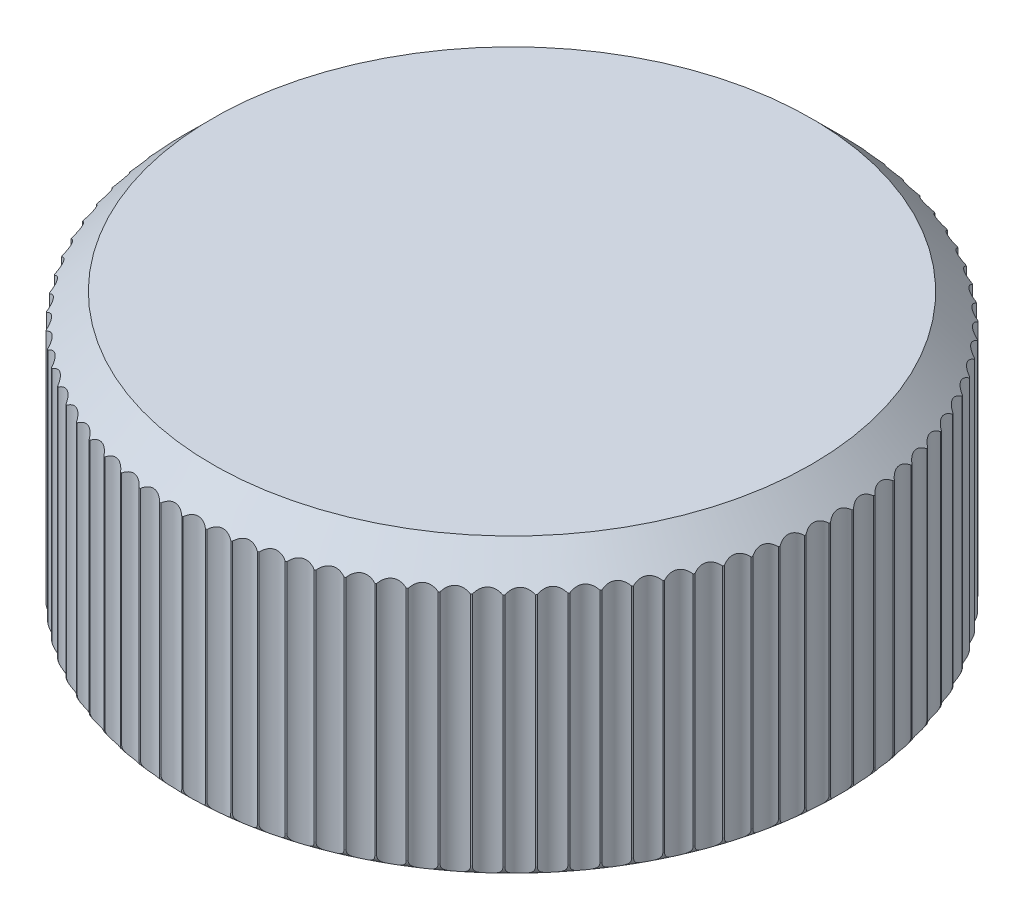
from build123d import *

# Parameters (mm, degrees)
SKIZZE2_R                       = 18.511660762
SCHNITT_LINEAR_AUSTRAGEN1_DEPTH = 28.109776895


with BuildPart() as part:
    # Skizze1 → Rotation1 (revolve)
    with BuildSketch(Plane.XY, mode=Mode.PRIVATE) as rotation1_sk:
        with BuildLine():
            Line((0, 8), (0, 13.8))
            Line((0, 13.8), (-15, 13.8))
            Line((-15, 13.8), (-16.5, 12.3))
            Line((-16.5, 12.3), (-16.5, 0.5))
            ThreePointArc((-16.5, 0.5), (-16.353553391, 0.146446609), (-16, 0))
            Line((-16, 0), (-15, 0))
            ThreePointArc((-15, 0), (-14.646446609, 0.146446609), (-14.5, 0.5))
            Line((-14.5, 0.5), (-14.5, 5.5))
            ThreePointArc((-14.5, 5.5), (-14.353553391, 5.853553391), (-14, 6))
            Line((-14, 6), (-6, 6))
            ThreePointArc((-6, 6), (-5.646446609, 5.853553391), (-5.5, 5.5))
            Line((-5.5, 5.5), (-5.5, 0.5))
            ThreePointArc((-5.5, 0.5), (-5.353553391, 0.146446609), (-5, 0))
            Line((-5, 0), (-3, 0))
            Line((-3, 0), (-3, 7.5))
            ThreePointArc((-3, 7.5), (-2.853553391, 7.853553391), (-2.5, 8))
            Line((-2.5, 8), (0, 8))
        make_face()
    revolve(rotation1_sk.sketch.rotate(Axis((0, 8, 0), (0, 1, 0)), 180), axis=Axis((0, 8, 0), (0, 1, 0)))

    # Skizze2 → Schnitt-Linear austragen1 (cut, through all)
    with BuildSketch(Plane(origin=(0, 13.8, 0), x_dir=(1, 0, 0), z_dir=(0, 1, 0))):
        Circle(SKIZZE2_R)
        with BuildLine():
            ThreePointArc((16.520557527, 0.576910581), (16.302627078, 0), (16.520557527, -0.576910581))
            ThreePointArc((16.520557527, -0.576910581), (16.262914698, -1.137213778), (16.440071032, -1.727921094))
            ThreePointArc((16.440071032, -1.727921094), (16.143971032, -2.268887164), (16.279490163, -2.870513348))
            ThreePointArc((16.279490163, -2.870513348), (15.946375562, -3.389506761), (16.039597254, -3.99912075))
            ThreePointArc((16.039597254, -3.99912075), (15.671090954, -4.493613021), (15.72156104, -5.108244837))
            ThreePointArc((15.72156104, -5.108244837), (15.319458365, -5.57582685), (15.32693096, -6.192482069))
            ThreePointArc((15.32693096, -6.192482069), (14.893190915, -6.630875811), (14.857629614, -7.246550151))
            ThreePointArc((14.857629614, -7.246550151), (14.394365336, -7.653619812), (14.315943389, -8.26531377))
            ThreePointArc((14.315943389, -8.26531377), (13.825411856, -8.639076146), (13.704511328, -9.24380961))
            ThreePointArc((13.704511328, -9.24380961), (13.189102359, -9.58244377), (13.026312265, -10.177270539))
            ThreePointArc((13.026312265, -10.177270539), (12.488536882, -10.479126691), (12.284650318, -11.061148829))
            ThreePointArc((12.284650318, -11.061148829), (11.727128508, -11.324756361), (11.483138789, -11.891138313))
            ThreePointArc((11.483138789, -11.891138313), (10.908586742, -12.115212955), (10.625682563, -12.663195368))
            ThreePointArc((10.625682563, -12.663195368), (10.036899439, -12.84664545), (9.716459079, -13.373558607))
            ThreePointArc((9.716459079, -13.373558607), (9.11631337, -13.515490379), (8.759897983, -14.018767213))
            ThreePointArc((8.759897983, -14.018767213), (8.151313539, -14.118489198), (7.760659545, -14.595677794))
            ThreePointArc((7.760659545, -14.595677794), (7.146601328, -14.652704157), (6.723611953, -15.1014797))
            ThreePointArc((6.723611953, -15.1014797), (6.107071594, -15.115532614), (5.6538076, -15.533708715))
            ThreePointArc((5.6538076, -15.533708715), (5.03778882, -15.504719716), (4.556458465, -15.890259063))
            ThreePointArc((4.556458465, -15.890259063), (3.943962446, -15.818369381), (3.436910722, -16.169393666))
            ThreePointArc((3.436910722, -16.169393666), (2.830921483, -16.054953541), (2.300618695, -16.369752608))
            ThreePointArc((2.300618695, -16.369752608), (1.704088556, -16.213319582), (1.153118286, -16.490359761))
            ThreePointArc((1.153118286, -16.490359761), (0.56895348, -16.292695959), (0, -16.530627539))
            ThreePointArc((0, -16.530627539), (-0.56895348, -16.292695959), (-1.153118286, -16.490359761))
            ThreePointArc((-1.153118286, -16.490359761), (-1.704088556, -16.213319582), (-2.300618695, -16.369752608))
            ThreePointArc((-2.300618695, -16.369752608), (-2.830921483, -16.054953541), (-3.436910722, -16.169393666))
            ThreePointArc((-3.436910722, -16.169393666), (-3.943962446, -15.818369381), (-4.556458465, -15.890259063))
            ThreePointArc((-4.556458465, -15.890259063), (-5.03778882, -15.504719716), (-5.6538076, -15.533708715))
            ThreePointArc((-5.6538076, -15.533708715), (-6.107071594, -15.115532614), (-6.723611953, -15.1014797))
            ThreePointArc((-6.723611953, -15.1014797), (-7.146601328, -14.652704157), (-7.760659545, -14.595677794))
            ThreePointArc((-7.760659545, -14.595677794), (-8.151313539, -14.118489198), (-8.759897983, -14.018767213))
            ThreePointArc((-8.759897983, -14.018767213), (-9.11631337, -13.515490379), (-9.716459079, -13.373558607))
            ThreePointArc((-9.716459079, -13.373558607), (-10.036899439, -12.84664545), (-10.625682563, -12.663195368))
            ThreePointArc((-10.625682563, -12.663195368), (-10.908586742, -12.115212955), (-11.483138789, -11.891138313))
            ThreePointArc((-11.483138789, -11.891138313), (-11.727128508, -11.324756361), (-12.284650318, -11.061148829))
            ThreePointArc((-12.284650318, -11.061148829), (-12.488536882, -10.479126691), (-13.026312265, -10.177270539))
            ThreePointArc((-13.026312265, -10.177270539), (-13.189102359, -9.58244377), (-13.704511328, -9.24380961))
            ThreePointArc((-13.704511328, -9.24380961), (-13.825411856, -8.639076146), (-14.315943389, -8.26531377))
            ThreePointArc((-14.315943389, -8.26531377), (-14.394365336, -7.653619812), (-14.857629614, -7.246550151))
            ThreePointArc((-14.857629614, -7.246550151), (-14.893190915, -6.630875811), (-15.32693096, -6.192482069))
            ThreePointArc((-15.32693096, -6.192482069), (-15.319458365, -5.57582685), (-15.72156104, -5.108244837))
            ThreePointArc((-15.72156104, -5.108244837), (-15.671090954, -4.493613021), (-16.039597254, -3.99912075))
            ThreePointArc((-16.039597254, -3.99912075), (-15.946375562, -3.389506761), (-16.279490163, -2.870513348))
            ThreePointArc((-16.279490163, -2.870513348), (-16.143971032, -2.268887164), (-16.440071032, -1.727921094))
            ThreePointArc((-16.440071032, -1.727921094), (-16.262914698, -1.137213778), (-16.520557527, -0.576910581))
            ThreePointArc((-16.520557527, -0.576910581), (-16.302627078, 0), (-16.520557527, 0.576910581))
            ThreePointArc((-16.520557527, 0.576910581), (-16.262914698, 1.137213778), (-16.440071032, 1.727921094))
            ThreePointArc((-16.440071032, 1.727921094), (-16.143971032, 2.268887164), (-16.279490163, 2.870513348))
            ThreePointArc((-16.279490163, 2.870513348), (-15.946375562, 3.389506761), (-16.039597254, 3.99912075))
            ThreePointArc((-16.039597254, 3.99912075), (-15.671090954, 4.493613021), (-15.72156104, 5.108244837))
            ThreePointArc((-15.72156104, 5.108244837), (-15.319458365, 5.57582685), (-15.32693096, 6.192482069))
            ThreePointArc((-15.32693096, 6.192482069), (-14.893190915, 6.630875811), (-14.857629614, 7.246550151))
            ThreePointArc((-14.857629614, 7.246550151), (-14.394365336, 7.653619812), (-14.315943389, 8.26531377))
            ThreePointArc((-14.315943389, 8.26531377), (-13.825411856, 8.639076146), (-13.704511328, 9.24380961))
            ThreePointArc((-13.704511328, 9.24380961), (-13.189102359, 9.58244377), (-13.026312265, 10.177270539))
            ThreePointArc((-13.026312265, 10.177270539), (-12.488536882, 10.479126691), (-12.284650318, 11.061148829))
            ThreePointArc((-12.284650318, 11.061148829), (-11.727128508, 11.324756361), (-11.483138789, 11.891138313))
            ThreePointArc((-11.483138789, 11.891138313), (-10.908586742, 12.115212955), (-10.625682563, 12.663195368))
            ThreePointArc((-10.625682563, 12.663195368), (-10.036899439, 12.84664545), (-9.716459079, 13.373558607))
            ThreePointArc((-9.716459079, 13.373558607), (-9.11631337, 13.515490379), (-8.759897983, 14.018767213))
            ThreePointArc((-8.759897983, 14.018767213), (-8.151313539, 14.118489198), (-7.760659545, 14.595677794))
            ThreePointArc((-7.760659545, 14.595677794), (-7.146601328, 14.652704157), (-6.723611953, 15.1014797))
            ThreePointArc((-6.723611953, 15.1014797), (-6.107071594, 15.115532614), (-5.6538076, 15.533708715))
            ThreePointArc((-5.6538076, 15.533708715), (-5.03778882, 15.504719716), (-4.556458465, 15.890259063))
            ThreePointArc((-4.556458465, 15.890259063), (-3.943962446, 15.818369381), (-3.436910722, 16.169393666))
            ThreePointArc((-3.436910722, 16.169393666), (-2.830921483, 16.054953541), (-2.300618695, 16.369752608))
            ThreePointArc((-2.300618695, 16.369752608), (-1.704088556, 16.213319582), (-1.153118286, 16.490359761))
            ThreePointArc((-1.153118286, 16.490359761), (-0.56895348, 16.292695959), (0, 16.530627539))
            ThreePointArc((0, 16.530627539), (0.56895348, 16.292695959), (1.153118286, 16.490359761))
            ThreePointArc((1.153118286, 16.490359761), (1.704088556, 16.213319582), (2.300618695, 16.369752608))
            ThreePointArc((2.300618695, 16.369752608), (2.830921483, 16.054953541), (3.436910722, 16.169393666))
            ThreePointArc((3.436910722, 16.169393666), (3.943962446, 15.818369381), (4.556458465, 15.890259063))
            ThreePointArc((4.556458465, 15.890259063), (5.03778882, 15.504719716), (5.6538076, 15.533708715))
            ThreePointArc((5.6538076, 15.533708715), (6.107071594, 15.115532614), (6.723611953, 15.1014797))
            ThreePointArc((6.723611953, 15.1014797), (7.146601328, 14.652704157), (7.760659545, 14.595677794))
            ThreePointArc((7.760659545, 14.595677794), (8.151313539, 14.118489198), (8.759897983, 14.018767213))
            ThreePointArc((8.759897983, 14.018767213), (9.11631337, 13.515490379), (9.716459079, 13.373558607))
            ThreePointArc((9.716459079, 13.373558607), (10.036899439, 12.84664545), (10.625682563, 12.663195368))
            ThreePointArc((10.625682563, 12.663195368), (10.908586742, 12.115212955), (11.483138789, 11.891138313))
            ThreePointArc((11.483138789, 11.891138313), (11.727128508, 11.324756361), (12.284650318, 11.061148829))
            ThreePointArc((12.284650318, 11.061148829), (12.488536882, 10.479126691), (13.026312265, 10.177270539))
            ThreePointArc((13.026312265, 10.177270539), (13.189102359, 9.58244377), (13.704511328, 9.24380961))
            ThreePointArc((13.704511328, 9.24380961), (13.825411856, 8.639076146), (14.315943389, 8.26531377))
            ThreePointArc((14.315943389, 8.26531377), (14.394365336, 7.653619812), (14.857629614, 7.246550151))
            ThreePointArc((14.857629614, 7.246550151), (14.893190915, 6.630875811), (15.32693096, 6.192482069))
            ThreePointArc((15.32693096, 6.192482069), (15.319458365, 5.57582685), (15.72156104, 5.108244837))
            ThreePointArc((15.72156104, 5.108244837), (15.671090954, 4.493613021), (16.039597254, 3.99912075))
            ThreePointArc((16.039597254, 3.99912075), (15.946375562, 3.389506761), (16.279490163, 2.870513348))
            ThreePointArc((16.279490163, 2.870513348), (16.143971032, 2.268887164), (16.440071032, 1.727921094))
            ThreePointArc((16.440071032, 1.727921094), (16.262914698, 1.137213778), (16.520557527, 0.576910581))
        make_face(mode=Mode.SUBTRACT)
    extrude(amount=-SCHNITT_LINEAR_AUSTRAGEN1_DEPTH, mode=Mode.SUBTRACT)


solid = part.part
